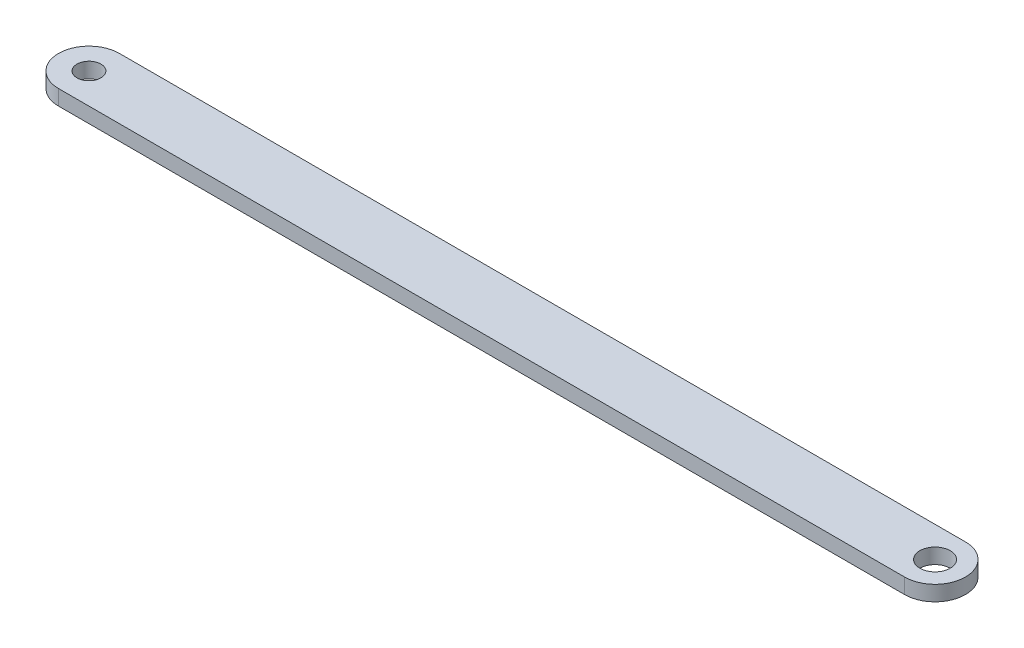
from build123d import *

# Parameters (mm, degrees)
SKETCH1_R           = 2.5
SKETCH1_R_2         = 3.175
BOSS_EXTRUDE1_DEPTH = 3.175


with BuildPart() as part:
    # Sketch1 → Boss-Extrude1 (new body)
    with BuildSketch(Plane(origin=(0, 0, 0), x_dir=(1, 0, 0), z_dir=(0, 1, 0))):
        with BuildLine():
            Line((0, 6.35), (176.54778, 6.35))
            ThreePointArc((176.54778, 6.35), (182.89778, 0), (176.54778, -6.35))
            Line((176.54778, -6.35), (0, -6.35))
            ThreePointArc((0, -6.35), (-6.35, 0), (0, 6.35))
        make_face()
        with Locations(Location((0, 0, 0), (0, 0, 270))):
            Circle(SKETCH1_R, mode=Mode.SUBTRACT)
        with Locations(Location((176.54778, 0, 0), (0, 0, 270))):
            Circle(SKETCH1_R_2, mode=Mode.SUBTRACT)
    extrude(amount=BOSS_EXTRUDE1_DEPTH)


solid = part.part
